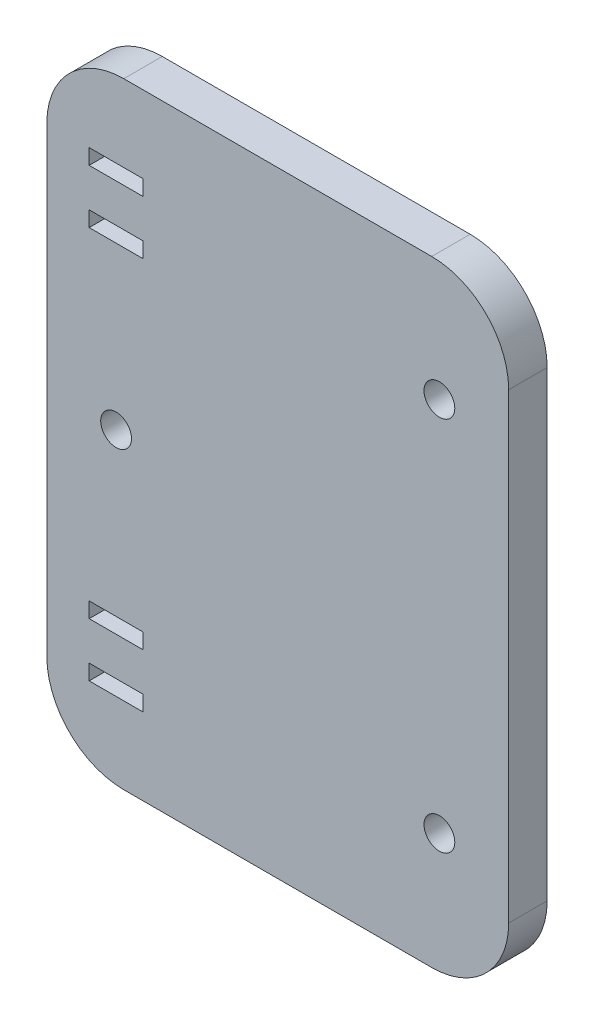
from build123d import *

# Parameters (mm, degrees)
SKETCH1_W           = 60
SKETCH1_H           = 80
BOSS_EXTRUDE1_DEPTH = 5
SKETCH2_R           = 2
CUT_EXTRUDE1_DEPTH  = 5
SKETCH3_W           = 7
SKETCH3_H           = 2
CUT_EXTRUDE2_DEPTH  = 5
FILLET2_R           = 10


with BuildPart() as part:
    # Sketch1 → Boss-Extrude1 (new body)
    with BuildSketch(Plane.XY):
        with Locations((-30, 40)):
            Rectangle(SKETCH1_W, SKETCH1_H)
    extrude(amount=BOSS_EXTRUDE1_DEPTH)

    # Sketch2 → Cut-Extrude1 (cut)
    with BuildSketch(Plane.XY.offset(5)):
        with Locations((-51, 40)):
            Circle(SKETCH2_R)
        with Locations((-9, 64.411542732)):
            Circle(SKETCH2_R)
        with Locations((-9, 15.588457268)):
            Circle(SKETCH2_R)
    extrude(amount=-CUT_EXTRUDE1_DEPTH, mode=Mode.SUBTRACT)

    # Sketch3 → Cut-Extrude2 (cut)
    with BuildSketch(Plane.XY.offset(5)):
        with Locations((-51, 69)):
            Rectangle(SKETCH3_W, SKETCH3_H)
        with Locations((-51, 62)):
            Rectangle(SKETCH3_W, SKETCH3_H)
        with Locations((-51, 18)):
            Rectangle(SKETCH3_W, SKETCH3_H)
        with Locations((-51, 11)):
            Rectangle(SKETCH3_W, SKETCH3_H)
    extrude(amount=-CUT_EXTRUDE2_DEPTH, mode=Mode.SUBTRACT)

    # Fillet2
    fillet2_edges = [part.edges().sort_by_distance(p)[0] for p in [
        (-60, 0, 2.5),
        (-60, 80, 2.5),
        (0, 80, 2.5),
        (0, 0, 2.5),
    ]]
    fillet(fillet2_edges, radius=FILLET2_R)


solid = part.part
